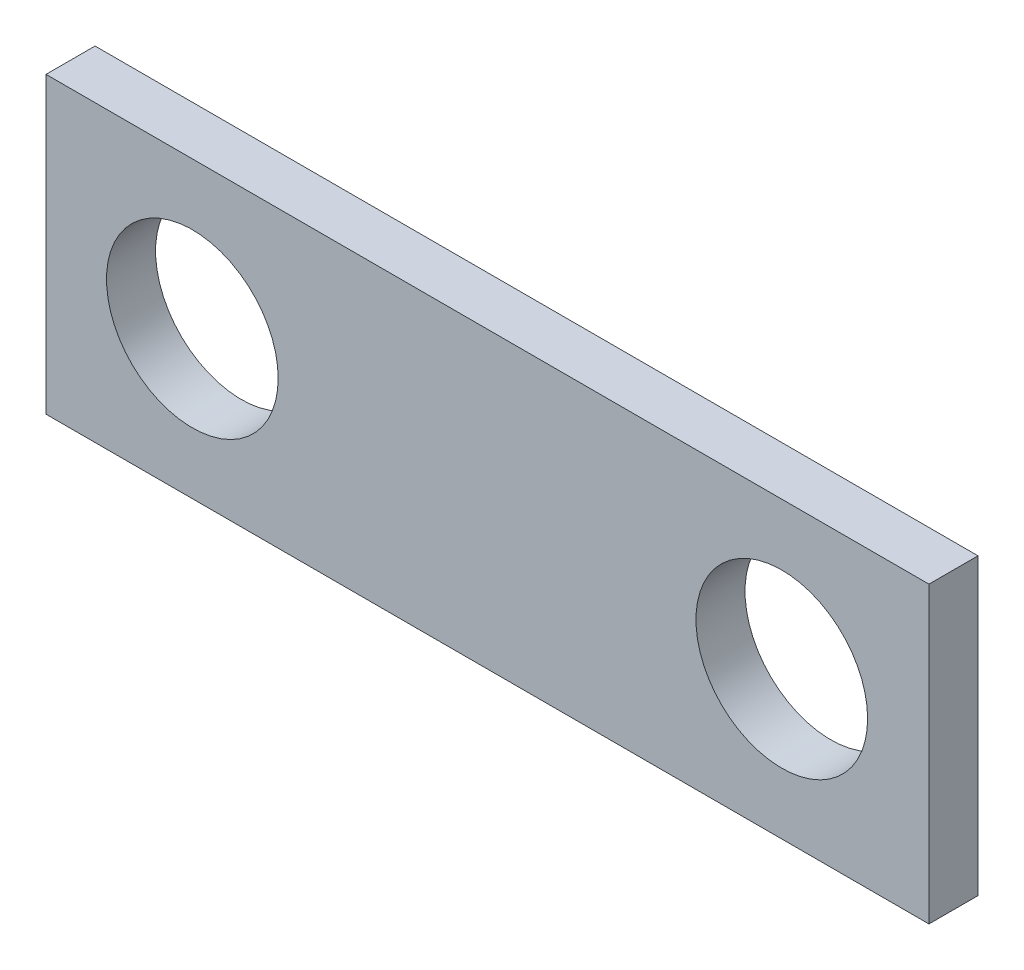
from build123d import *

# Parameters (mm, degrees)
SKETCH1_W           = 114.3
SKETCH1_H           = 38.1
BOSS_EXTRUDE1_DEPTH = 6.35
SKETCH2_R           = 11.1125
CUT_EXTRUDE1_DEPTH  = 61.57513929


with BuildPart() as part:
    # Sketch1 → Boss-Extrude1 (new body)
    with BuildSketch(Plane.XY):
        Rectangle(SKETCH1_W, SKETCH1_H)
    extrude(amount=BOSS_EXTRUDE1_DEPTH)

    # Sketch2 → Cut-Extrude1 (cut, through all)
    with BuildSketch(Plane.XY.offset(6.35)):
        with Locations((-38.205321874, 0)):
            Circle(SKETCH2_R)
        with Locations((38.1, 0)):
            Circle(SKETCH2_R)
    extrude(amount=-CUT_EXTRUDE1_DEPTH, mode=Mode.SUBTRACT)


solid = part.part
